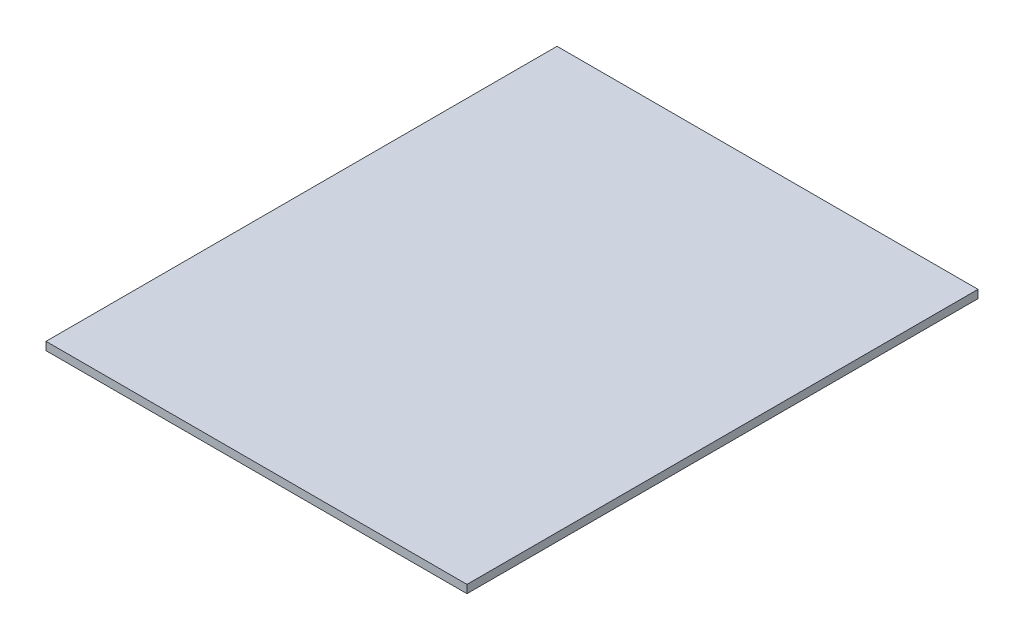
from build123d import *

# Parameters (mm, degrees)
SKETCH1_W           = 624
SKETCH1_H           = 12
DET_RAF_UST_1_DEPTH = 757.5


with BuildPart() as part:
    # Sketch1 → DET_raf_ust_1 (new body)
    with BuildSketch(Plane.XY):
        with Locations((1026, 1614)):
            Rectangle(SKETCH1_W, SKETCH1_H)
    extrude(amount=-DET_RAF_UST_1_DEPTH)


solid = part.part
